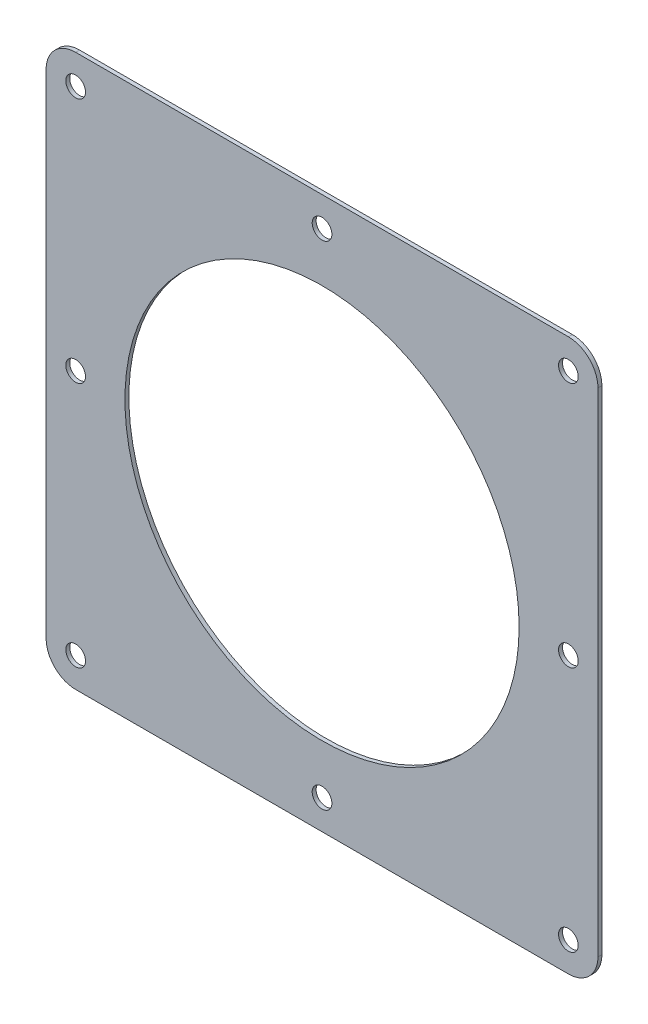
from build123d import *

# Parameters (mm, degrees)
SKETCH2_R           = 5
SKETCH2_R_2         = 4
BOSS_EXTRUDE1_DEPTH = 2
SKETCH7_R           = 100
CUT_EXTRUDE2_DEPTH  = 10


with BuildPart() as part:
    # Sketch2 → Boss-Extrude1 (new body)
    with BuildSketch(Plane.XY):
        with BuildLine():
            Line((-125, 140), (125, 140))
            ThreePointArc((125, 140), (135.606601718, 135.606601718), (140, 125))
            Line((140, 125), (140, -125))
            ThreePointArc((140, -125), (135.606601718, -135.606601718), (125, -140))
            Line((125, -140), (-125, -140))
            ThreePointArc((-125, -140), (-135.606601718, -135.606601718), (-140, -125))
            Line((-140, -125), (-140, 125))
            ThreePointArc((-140, 125), (-135.606601718, 135.606601718), (-125, 140))
        make_face()
        with Locations((-125, 125)):
            Circle(SKETCH2_R, mode=Mode.SUBTRACT)
        with Locations((0, 125)):
            Circle(SKETCH2_R, mode=Mode.SUBTRACT)
        with Locations((125, 125)):
            Circle(SKETCH2_R, mode=Mode.SUBTRACT)
        Circle(SKETCH2_R_2, mode=Mode.SUBTRACT)
        with Locations((125, 0)):
            Circle(SKETCH2_R, mode=Mode.SUBTRACT)
        with Locations((-125, 0)):
            Circle(SKETCH2_R, mode=Mode.SUBTRACT)
        with Locations((-125, -125)):
            Circle(SKETCH2_R, mode=Mode.SUBTRACT)
        with Locations((0, -125)):
            Circle(SKETCH2_R, mode=Mode.SUBTRACT)
        with Locations((125, -125)):
            Circle(SKETCH2_R, mode=Mode.SUBTRACT)
    extrude(amount=BOSS_EXTRUDE1_DEPTH)

    # Sketch7 → Cut-Extrude2 (cut)
    with BuildSketch(Plane.XY.offset(2)):
        Circle(SKETCH7_R)
    extrude(amount=-CUT_EXTRUDE2_DEPTH, mode=Mode.SUBTRACT)


solid = part.part
